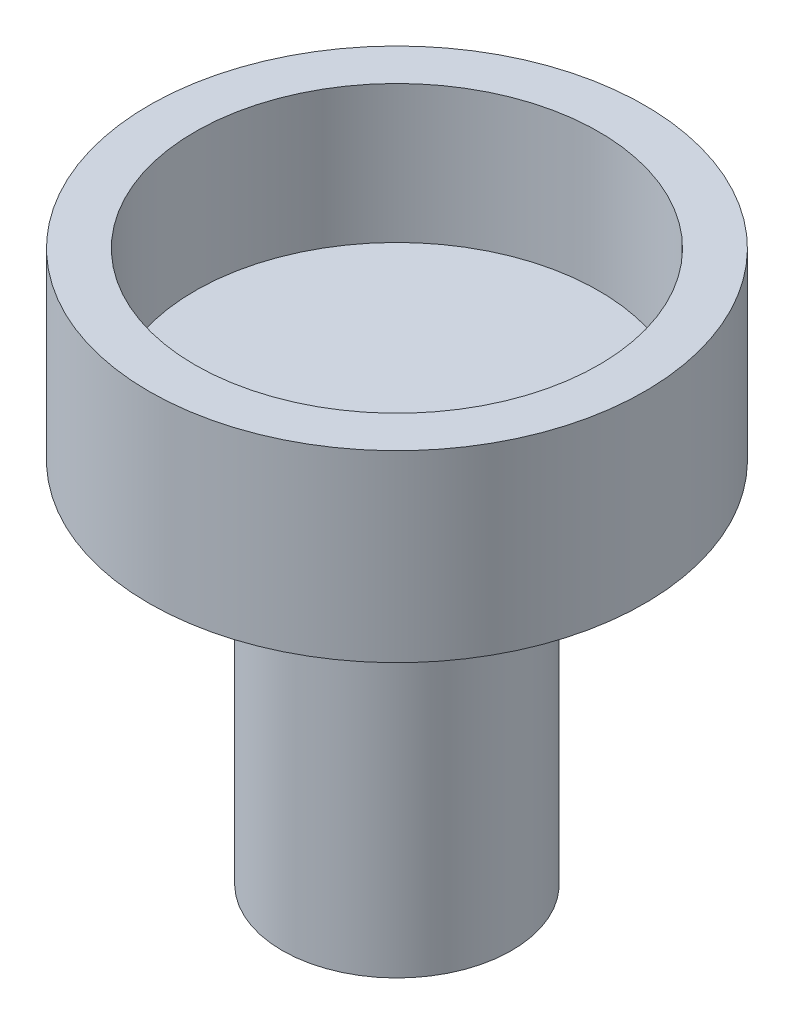
from build123d import *

# Parameters (mm, degrees)
BOTTOMBASES_R     = 1.25
BOTTOM_BASE_DEPTH = 4
MAINBASES_R       = 2.7
MAIN_BASE_DEPTH   = 0.5
WALLS_R           = 2.7
WALLS_R_2         = 2.2
WALL_DEPTH        = 1.5


with BuildPart() as part:
    # BottomBaseS → BOTTOM BASE (new body)
    with BuildSketch(Plane(origin=(0, 0, 0), x_dir=(1, 0, 0), z_dir=(0, 1, 0))):
        with Locations(Location((0, 0, 0), (0, 0, 270))):
            Circle(BOTTOMBASES_R)
    extrude(amount=-BOTTOM_BASE_DEPTH)

    # MainBaseS → MAIN BASE (add)
    with BuildSketch(Plane(origin=(0, 0, 0), x_dir=(1, 0, 0), z_dir=(0, 1, 0))):
        with Locations(Location((0, 0, 0), (0, 0, 270))):
            Circle(MAINBASES_R)
    extrude(amount=MAIN_BASE_DEPTH)

    # WallS → WALL (add)
    with BuildSketch(Plane(origin=(0, 0.5, 0), x_dir=(1, 0, 0), z_dir=(0, 1, 0))):
        with Locations(Location((0, 0, 0), (0, 0, 270))):
            Circle(WALLS_R)
        with Locations(Location((0, 0, 0), (0, 0, 270))):
            Circle(WALLS_R_2, mode=Mode.SUBTRACT)
    extrude(amount=WALL_DEPTH)


solid = part.part
